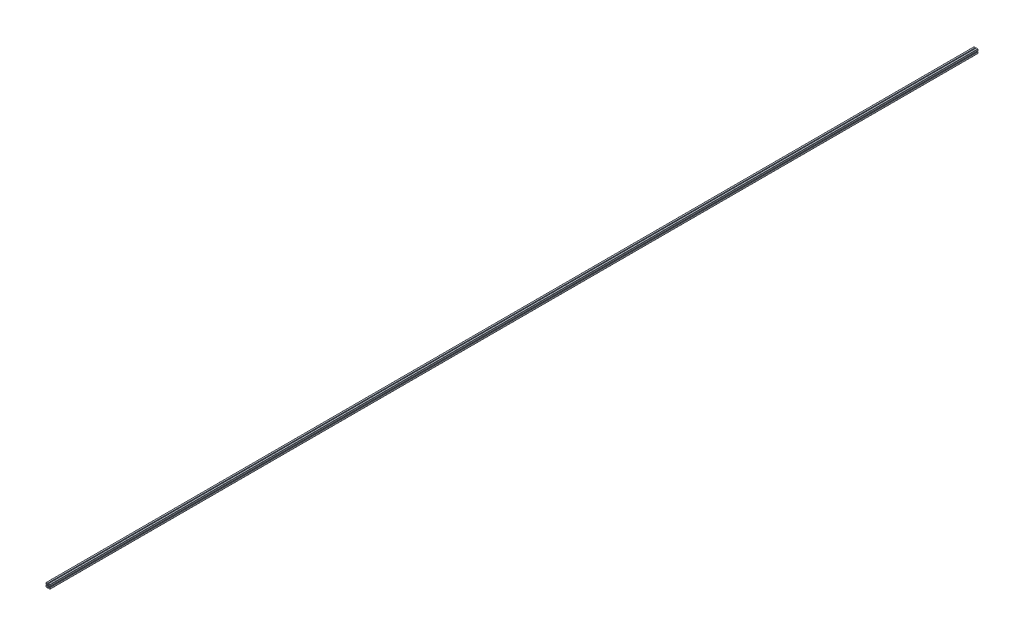
from build123d import *

# Parameters (mm, degrees)
SKETCH_1_W               = 40
SKETCH_1_H               = 40
EXTRUDE_1_DEPTH          = 9282.5
SKETCH_2_R               = 4.05
CUT_EXTRUDE_1_DEPTH      = 10000
CUT_EXTRUDE_2_DEPTH      = 10000
FILLET_1_R               = 1
PATTERN_CIRCULAR_2_COUNT = 4
FILLET_2_R               = 1
FILLET_3_R               = 1
FILLET_4_R               = 1
FILLET_5_R               = 2


with BuildPart() as part:
    # 草图1 → 凸台-拉伸1 (new body)
    with BuildSketch(Plane.XY):
        Rectangle(SKETCH_1_W, SKETCH_1_H)
    extrude(amount=EXTRUDE_1_DEPTH)

    # 草图2 → 切除-拉伸1 (cut)
    with BuildSketch(Plane.XY.offset(9282.5)):
        Circle(SKETCH_2_R)
    extrude(amount=-CUT_EXTRUDE_1_DEPTH, mode=Mode.SUBTRACT)

    # 草图4 → 切除-拉伸2 (cut)
    with BuildSketch(Plane.XY.offset(9282.5)):
        Polygon((20, 0), (20, 4), (16, 4), (16, 10.5), (7.876860985, 2.6), (7.876860985, -2.6), (16, -10.5), (16, -2.65197969), (20, -2.65197969), align=None)
    cut_extrude_2 = extrude(amount=-CUT_EXTRUDE_2_DEPTH, mode=Mode.SUBTRACT)

    # 圆角1
    fillet_1_edges = [part.edges().sort_by_distance(p)[0] for p in [
        (20, -2.65197969, 4641.25),
        (16, -2.65197969, 4641.25),
        (16, -10.5, 4641.25),
        (7.876860985, -2.6, 4641.25),
        (7.876860985, 2.6, 4641.25),
        (16, 10.5, 4641.25),
        (16, 4, 4641.25),
        (20, 4, 4641.25),
    ]]
    fillet(fillet_1_edges, radius=FILLET_1_R)

    # 阵列(圆周)2: 切除-拉伸2 ×4 about axis
    pattern_circular_2_axis = Axis((0, 0, 0), (0, 0, 1))
    for i in range(1, PATTERN_CIRCULAR_2_COUNT):
        add(cut_extrude_2.rotate(pattern_circular_2_axis, i * 360 / PATTERN_CIRCULAR_2_COUNT), mode=Mode.SUBTRACT)

    # 圆角2
    fillet_2_edges = [part.edges().sort_by_distance(p)[0] for p in [
        (2.65197969, 20, 4641.25),
        (2.65197969, 16, 4641.25),
        (10.5, 16, 4641.25),
        (2.6, 7.876860985, 4641.25),
        (-2.6, 7.876860985, 4641.25),
        (-10.5, 16, 4641.25),
        (-4, 16, 4641.25),
        (-4, 20, 4641.25),
    ]]
    fillet(fillet_2_edges, radius=FILLET_2_R)

    # 圆角3
    fillet_3_edges = [part.edges().sort_by_distance(p)[0] for p in [
        (-20, 2.65197969, 4641.25),
        (-16, 2.65197969, 4641.25),
        (-16, 10.5, 4641.25),
        (-7.876860985, 2.6, 4641.25),
        (-7.876860985, -2.6, 4641.25),
        (-16, -10.5, 4641.25),
        (-16, -4, 4641.25),
        (-20, -4, 4641.25),
    ]]
    fillet(fillet_3_edges, radius=FILLET_3_R)

    # 圆角4
    fillet_4_edges = [part.edges().sort_by_distance(p)[0] for p in [
        (-2.65197969, -20, 4641.25),
        (-2.65197969, -16, 4641.25),
        (-10.5, -16, 4641.25),
        (-2.6, -7.876860985, 4641.25),
        (2.6, -7.876860985, 4641.25),
        (10.5, -16, 4641.25),
        (4, -16, 4641.25),
        (4, -20, 4641.25),
    ]]
    fillet(fillet_4_edges, radius=FILLET_4_R)

    # 圆角5
    fillet_5_edges = [part.edges().sort_by_distance(p)[0] for p in [
        (20, -20, 4641.25),
        (-20, -20, 4641.25),
        (-20, 20, 4641.25),
        (20, 20, 4641.25),
    ]]
    fillet(fillet_5_edges, radius=FILLET_5_R)


solid = part.part
